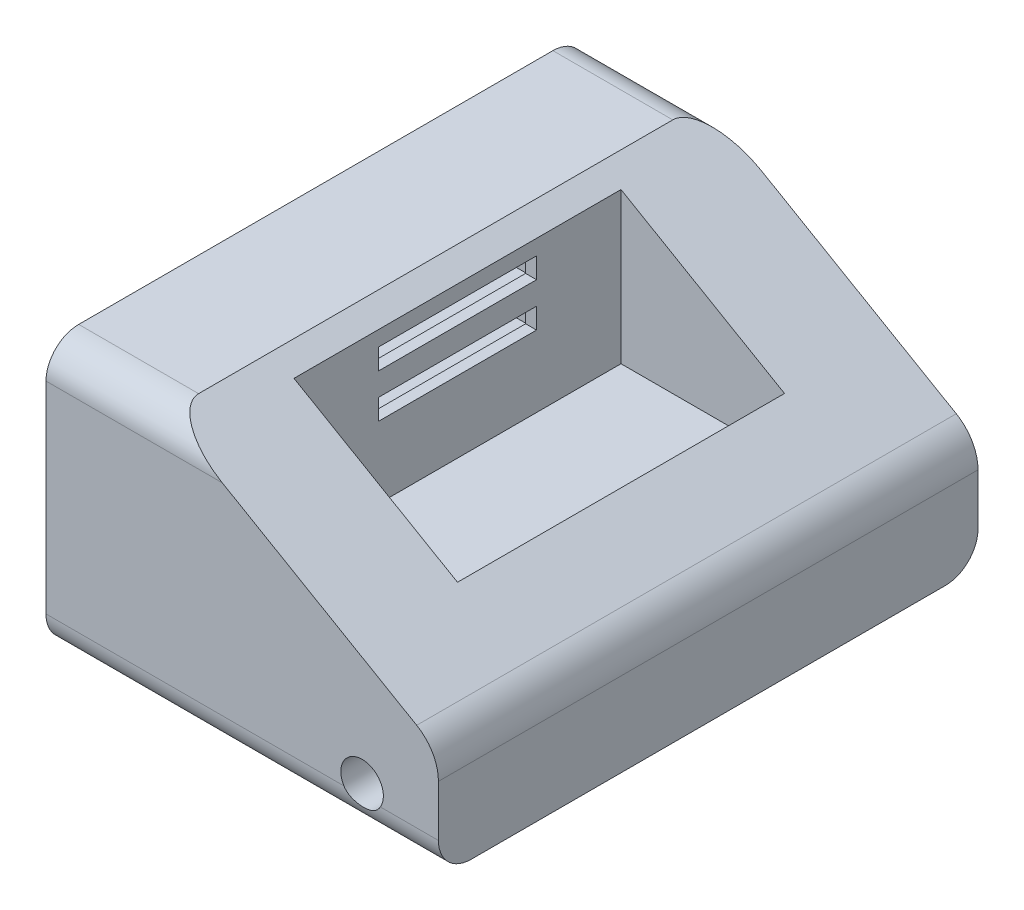
from build123d import *
from build123d.topology import SkipClean

# Parameters (mm, degrees)
SKETCH_1_W               = 49.5
SKETCH_1_H               = 24.5
EXTRUDE_1_DEPTH          = 36
SKETCH_2_R               = 2.5
CUT_EXTRUDE_1_DEPTH      = 3
SKETCH_3_W               = 15.2
SKETCH_3_H               = 2.5
CUT_EXTRUDE_2_DEPTH      = 12
FILLET_1_R               = 3
CUT_EXTRUDE_3_DEPTH      = 46.372072908
CUT_EXTRUDE_3_DEPTH_BACK = 46.372072908
SKETCH_5_R               = 1.95
CUT_EXTRUDE_4_DEPTH      = 63.42044953
CUT_EXTRUDE_4_DEPTH_BACK = 3
SKETCH_6_R               = 4
SKETCH_7_W               = 10
SKETCH_7_H               = 9
CUT_EXTRUDE_5_DEPTH      = 7.5
CUT_EXTRUDE_6_DEPTH      = 63.42044953
FILLET_2_R               = 4
SKETCH_9_W               = 15
SKETCH_9_H               = 30
CUT_EXTRUDE_7_DEPTH      = 15
SKETCH_11_W              = 14.5
SKETCH_11_H              = 1.9
CUT_EXTRUDE_8_DEPTH      = 2


with BuildPart() as part:
    # Эскиз1 → Бобышка-Вытянуть1 (new body)
    with BuildSketch(Plane(origin=(0, 0, 0), x_dir=(0, 0, -1), z_dir=(1, 0, 0))):
        Rectangle(SKETCH_1_W, SKETCH_1_H)
    extrude(amount=EXTRUDE_1_DEPTH)

    # Эскиз2 → Вырез-Вытянуть1 (cut)
    with BuildSketch(Plane.ZY):
        with Locations((-20, -7.25)):
            Circle(SKETCH_2_R)
        with Locations((20, -7.25)):
            Circle(SKETCH_2_R)
    extrude(amount=-CUT_EXTRUDE_1_DEPTH, mode=Mode.SUBTRACT)

    # Эскиз3 → Вырез-Вытянуть2 (cut)
    with BuildSketch(Plane.ZY):
        with Locations((0, 4.75)):
            Rectangle(SKETCH_3_W, SKETCH_3_H)
        with Locations((0, 8.75)):
            Rectangle(SKETCH_3_W, SKETCH_3_H)
    extrude(amount=-CUT_EXTRUDE_2_DEPTH, mode=Mode.SUBTRACT)

    # Скругление1
    fillet_1_edges = [part.edges().sort_by_distance(p)[0] for p in [
        (18, 12.25, -24.75),
        (18, -12.25, -24.75),
        (18, -12.25, 24.75),
        (18, 12.25, 24.75),
    ]]
    fillet(fillet_1_edges, radius=FILLET_1_R)

    # Эскиз5 → Вырез-Вытянуть3 (cut, two sides: drawn at the far end of the back side and taken through both)
    with BuildSketch(Plane.XY.offset(-CUT_EXTRUDE_3_DEPTH_BACK)):
        with Locations(Location((29, -8.25, 0), (0, 0, 329.148114014))):
            Circle(SKETCH_5_R)
    extrude(amount=CUT_EXTRUDE_3_DEPTH + CUT_EXTRUDE_3_DEPTH_BACK, mode=Mode.SUBTRACT)

    # Эскиз6 → Вырез-Вытянуть4 (cut, two sides: drawn at the far end of the back side and taken through both)
    with BuildSketch(Plane(origin=(0, 0, -24.75), x_dir=(-1, 0, 0), z_dir=(0, 0, -1)).offset(-CUT_EXTRUDE_4_DEPTH_BACK)):
        with Locations((-29, -8.25)):
            Circle(SKETCH_6_R)
    extrude(amount=CUT_EXTRUDE_4_DEPTH + CUT_EXTRUDE_4_DEPTH_BACK, mode=Mode.SUBTRACT)

    # Эскиз7 → Вырез-Вытянуть5 (cut, symmetric)
    with SkipClean():  # the faces are left unmerged after this step: merging them gives an invalid solid
        with BuildSketch(Plane.XY):
            with Locations((29, -7.75)):
                Rectangle(SKETCH_7_W, SKETCH_7_H)
        extrude(amount=CUT_EXTRUDE_5_DEPTH, both=True, mode=Mode.SUBTRACT)

    # Эскиз8 → Вырез-Вытянуть6 (cut, through all)
    with SkipClean():  # the faces are left unmerged after this step: merging them gives an invalid solid
        with BuildSketch(Plane(origin=(0, 0, -24.75), x_dir=(-1, 0, 0), z_dir=(0, 0, -1))):
            Polygon((-11, 12.25), (-36, -2.25), (-36, 12.25), align=None)
        extrude(amount=-CUT_EXTRUDE_6_DEPTH, mode=Mode.SUBTRACT)

    # Скругление2
    fillet_2_edges = [part.edges().sort_by_distance(p)[0] for p in [
        (36, -2.25, 0),
    ]]
    fillet(fillet_2_edges, radius=FILLET_2_R)

    # Эскиз9 → Вырез-Вытянуть7 (cut)
    with BuildSketch(Plane.XZ.offset(-12.25)):
        with Locations((20.5, 0)):
            Rectangle(SKETCH_9_W, SKETCH_9_H)
    extrude(amount=CUT_EXTRUDE_7_DEPTH, mode=Mode.SUBTRACT)

    # Эскиз11 → Вырез-Вытянуть8 (cut)
    with BuildSketch(Plane.ZY.offset(-12)):
        with Locations((0, 8.75)):
            Rectangle(SKETCH_11_W, SKETCH_11_H)
        with Locations((0, 4.75)):
            Rectangle(SKETCH_11_W, SKETCH_11_H)
    extrude(amount=-CUT_EXTRUDE_8_DEPTH, mode=Mode.SUBTRACT)


solid = part.part
